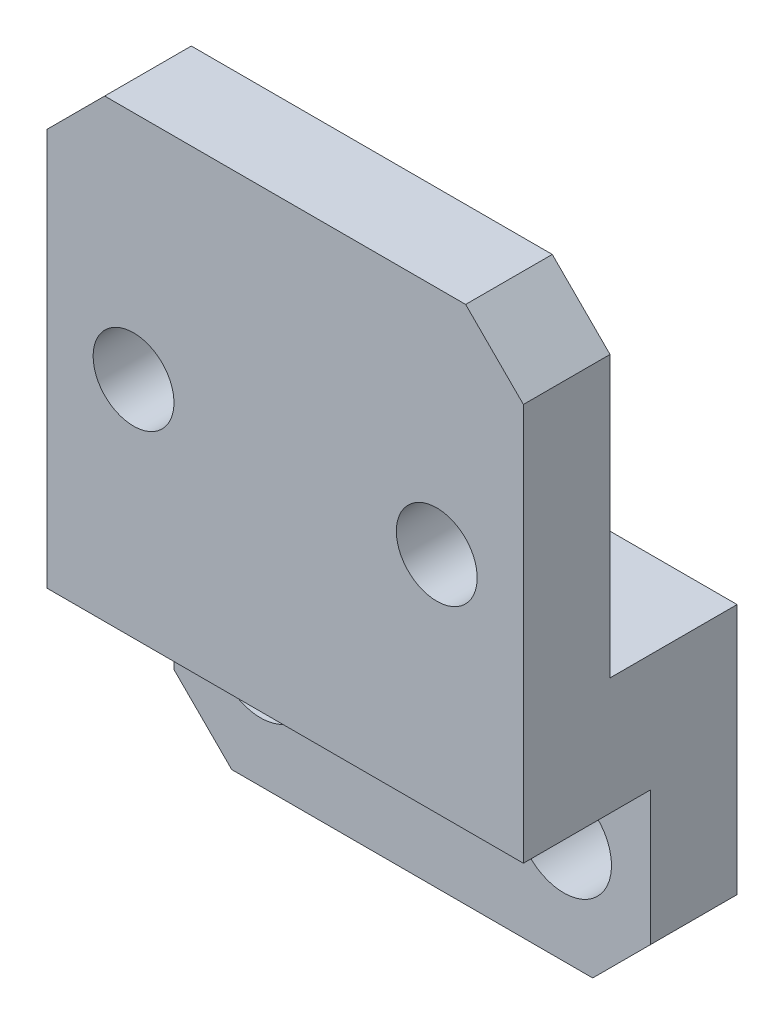
from build123d import *

# Parameters (mm, degrees)
SKETCH2_W           = 16.5
SKETCH2_H           = 15.758588826
BOSS_EXTRUDE1_DEPTH = 3
SKETCH3_W           = 16.5
SKETCH3_H           = 4.058588826
BOSS_EXTRUDE2_DEPTH = 1.4
SKETCH4_W           = 16.5
SKETCH4_H           = 10.7
SKETCH4_R           = 1.65
BOSS_EXTRUDE3_DEPTH = 3
SKETCH5_R           = 1.4
CUT_EXTRUDE1_DEPTH  = 3
CHAMFER1_SIZE       = 2
SKETCH6_R           = 4.45
CUT_EXTRUDE2_DEPTH  = 17


with BuildPart() as part:
    # Sketch2 → Boss-Extrude1 (new body)
    with BuildSketch(Plane.XY):
        with Locations((0, 3.620705587)):
            Rectangle(SKETCH2_W, SKETCH2_H)
    extrude(amount=BOSS_EXTRUDE1_DEPTH)

    # Sketch3 → Boss-Extrude2 (add)
    with BuildSketch(Plane(origin=(0, 0, 0), x_dir=(-1, 0, 0), z_dir=(0, 0, -1))):
        with Locations((0, -2.229294413)):
            Rectangle(SKETCH3_W, SKETCH3_H)
    extrude(amount=BOSS_EXTRUDE2_DEPTH)

    # Sketch4 → Boss-Extrude3 (add)
    with BuildSketch(Plane(origin=(0, 0, -1.4), x_dir=(-1, 0, 0), z_dir=(0, 0, -1))):
        with Locations((0, -5.55)):
            Rectangle(SKETCH4_W, SKETCH4_H)
        with Locations((-5.25, -7.2)):
            Circle(SKETCH4_R, mode=Mode.SUBTRACT)
        with Locations((5.25, -7.2)):
            Circle(SKETCH4_R, mode=Mode.SUBTRACT)
    extrude(amount=BOSS_EXTRUDE3_DEPTH)

    # Sketch5 → Cut-Extrude1 (cut)
    with BuildSketch(Plane(origin=(0, 0, 0), x_dir=(-1, 0, 0), z_dir=(0, 0, -1))):
        with Locations((-5.25, 3.5)):
            Circle(SKETCH5_R)
        with Locations((5.25, 3.5)):
            Circle(SKETCH5_R)
    extrude(amount=-CUT_EXTRUDE1_DEPTH, mode=Mode.SUBTRACT)

    # Chamfer1
    chamfer1_edges = [part.edges().sort_by_distance(p)[0] for p in [
        (8.25, -10.9, -2.9),
        (-8.25, -10.9, -2.9),
        (-8.25, 11.5, 1.5),
        (8.25, 11.5, 1.5),
    ]]
    chamfer(chamfer1_edges, length=CHAMFER1_SIZE)

    # Sketch6 → Cut-Extrude2 (cut)
    with BuildSketch(Plane(origin=(0, -0.2, 0), x_dir=(1, 0, 0), z_dir=(0, 1, 0))):
        with Locations((0, 8.5)):
            Circle(SKETCH6_R)
    extrude(amount=-CUT_EXTRUDE2_DEPTH, mode=Mode.SUBTRACT)


solid = part.part
